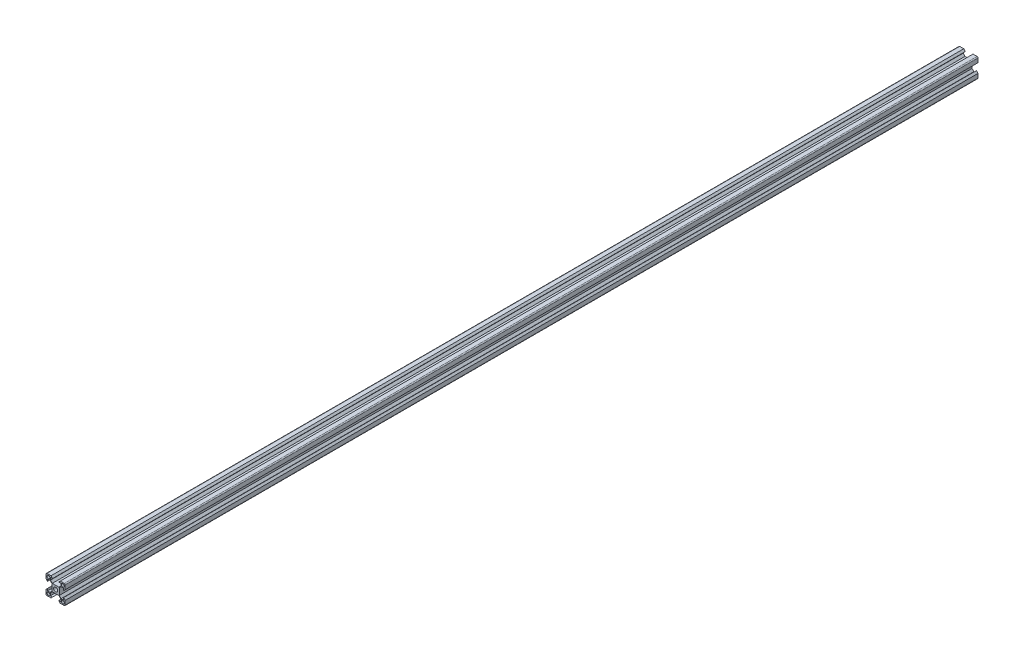
from build123d import *

# Parameters (mm, degrees)
SKETCH_1_R      = 1.5
SKETCH_1_R_2    = 2.1
EXTRUDE_1_DEPTH = 950
FILLET_1_R      = 1


with BuildPart() as part:
    # 草图1 → 凸台-拉伸1 (new body)
    with BuildSketch(Plane.XY):
        Polygon((-10, 10), (-10, 4.8), (-8.34, 3.14), (-8.34, 5.4), (-5.753553391, 5.4), (-3.8, 3.446446609), (-3.8, -3.446446609), (-5.753553391, -5.4), (-8.34, -5.4), (-8.34, -3.14), (-10, -4.8), (-10, -10), (-4.8, -10), (-3.14, -8.34), (-5.4, -8.34), (-5.4, -5.753553391), (-3.446446609, -3.8), (3.446446609, -3.8), (5.4, -5.753553391), (5.4, -8.34), (3.14, -8.34), (4.8, -10), (10, -10), (10, -4.8), (8.34, -3.14), (8.34, -5.4), (5.753553391, -5.4), (3.8, -3.446446609), (3.8, 3.446446609), (5.753553391, 5.4), (8.34, 5.4), (8.34, 3.14), (10, 4.8), (10, 10), (4.8, 10), (3.14, 8.34), (5.4, 8.34), (5.4, 5.753553391), (3.446446609, 3.8), (-3.446446609, 3.8), (-5.4, 5.753553391), (-5.4, 8.34), (-3.14, 8.34), (-4.8, 10), align=None)
        with Locations(Location((-7.5, 7.5, 0), (0, 0, 180))):
            Circle(SKETCH_1_R, mode=Mode.SUBTRACT)
        with Locations(Location((0, 0, 0), (0, 0, 180))):
            Circle(SKETCH_1_R_2, mode=Mode.SUBTRACT)
        with Locations(Location((-7.5, -7.5, 0), (0, 0, 180))):
            Circle(SKETCH_1_R, mode=Mode.SUBTRACT)
        with Locations(Location((7.5, -7.5, 0), (0, 0, 180))):
            Circle(SKETCH_1_R, mode=Mode.SUBTRACT)
        with Locations(Location((7.5, 7.5, 0), (0, 0, 180))):
            Circle(SKETCH_1_R, mode=Mode.SUBTRACT)
    extrude(amount=EXTRUDE_1_DEPTH)

    # 圆角1
    fillet_1_edges = [part.edges().sort_by_distance(p)[0] for p in [
        (10, 10, 475),
        (10, -10, 475),
        (-10, -10, 475),
        (-10, 10, 475),
    ]]
    fillet(fillet_1_edges, radius=FILLET_1_R)


solid = part.part
